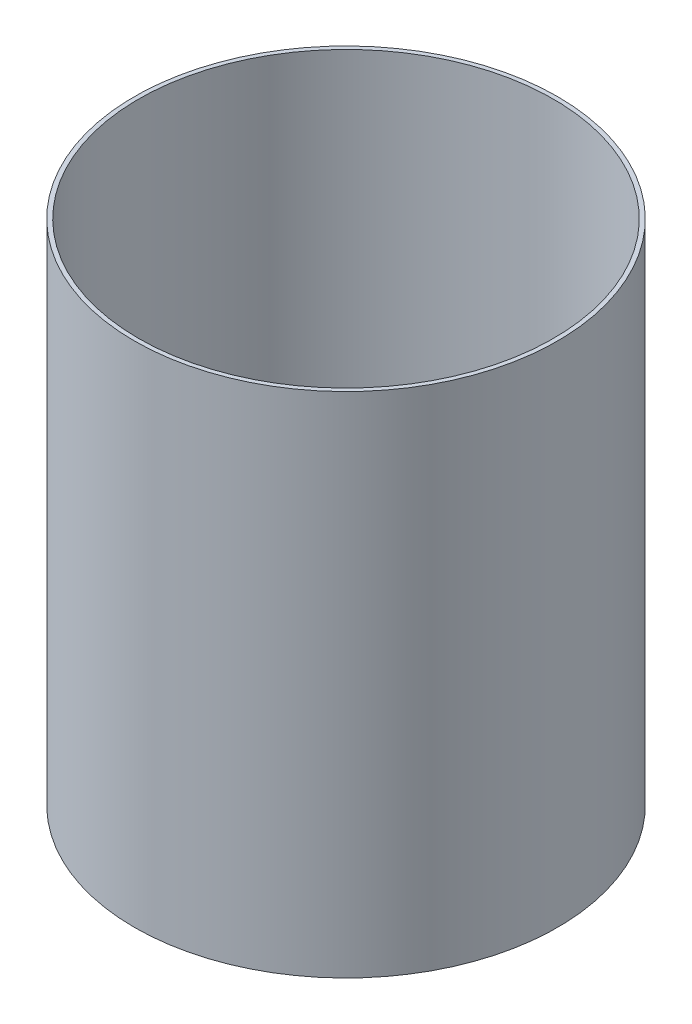
from build123d import *

# Parameters (mm, degrees)
SKETCH1_R           = 125
BOSS_EXTRUDE1_DEPTH = 300
SHELL2_T            = -2.5


with BuildPart() as part:
    # Sketch1 → Boss-Extrude1 (new body)
    with BuildSketch(Plane(origin=(0, 0, 0), x_dir=(1, 0, 0), z_dir=(0, 1, 0))):
        with Locations(Location((0, 0, 0), (0, 0, 270))):
            Circle(SKETCH1_R)
    extrude(amount=BOSS_EXTRUDE1_DEPTH)

    # Shell2
    shell2_openings = [part.faces().sort_by_distance(p)[0] for p in [
        (0, 300, 0),
    ]]
    offset(amount=SHELL2_T, openings=shell2_openings, kind=Kind.INTERSECTION)


solid = part.part
